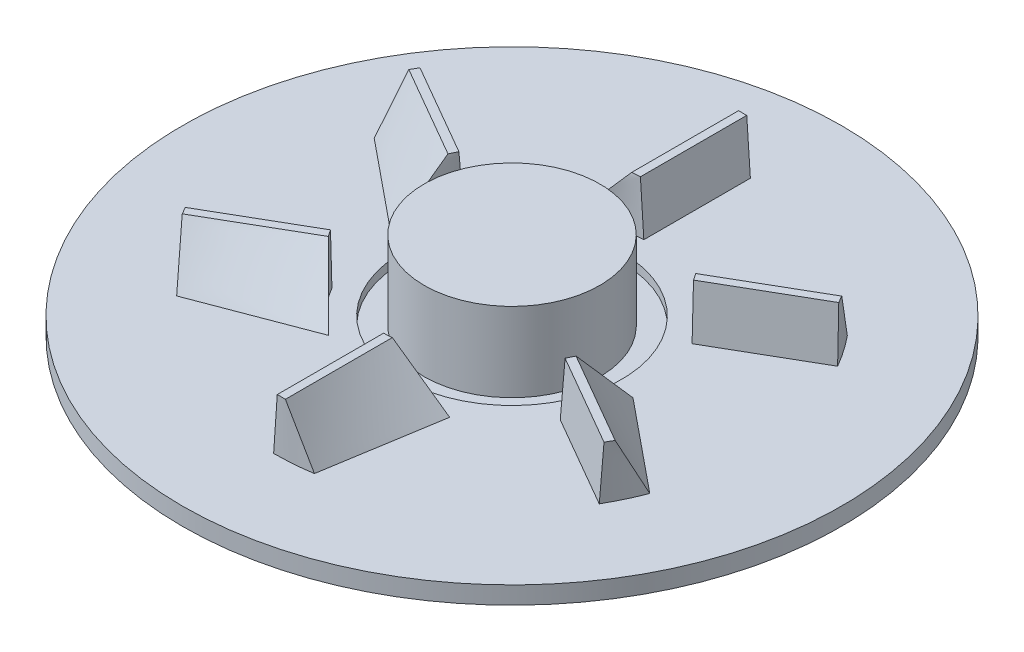
from build123d import *

# Parameters (mm, degrees)
SKETCH2_R           = 37.5
BOSS_EXTRUDE1_DEPTH = 2
CIRPATTERN1_COUNT   = 6
SKETCH6_R           = 12.5
CUT_EXTRUDE1_DEPTH  = 1
SKETCH7_R           = 10
BOSS_EXTRUDE2_DEPTH = 9
SKETCH8_R           = 5
CUT_EXTRUDE2_DEPTH  = 8


with BuildPart() as part:
    # Sketch2 → Boss-Extrude1 (new body)
    with BuildSketch(Plane(origin=(0, 0, 0), x_dir=(1, 0, 0), z_dir=(0, 1, 0))):
        with Locations(Location((0, 0, 0), (0, 0, 270))):
            Circle(SKETCH2_R)
    extrude(amount=BOSS_EXTRUDE1_DEPTH)

    # Sketch3 for Loft1 → Loft1 section 0
    with BuildSketch(Plane(origin=(0, 2, 0), x_dir=(1, 0, 0), z_dir=(0, 1, 0))):
        with BuildLine():
            Line((0, -15), (0, -27.124270964))
            # circular arc as an exact rational Bezier (weights 1, cos(half-angle), 1)
            Bezier((0, -27.124270964), (2.164566304, -27.124270964), (4.301737718, -26.780984447), weights=[1, 0.996830963, 1])
            Line((4.301737718, -26.780984447), (6.447780139, -13.543490366))
            Bezier((6.447780139, -13.543490366), (3.388397874, -15), (0, -15), weights=[1, 0.975422821, 1])
        make_face()
    # Sketch4 for Loft1 → Loft1 section 1
    with BuildSketch(Plane(origin=(0, 8, 0), x_dir=(1, 0, 0), z_dir=(0, 1, 0))):
        with BuildLine():
            Line((0.4, -15.012151174), (0.4, -27.112269684))
            Bezier((0.4, -27.112269684), (0.86490704, -27.099253481), (1.32975035, -27.114375462), weights=[1, 0.999542352, 1])
            Line((1.32975035, -27.114375462), (1.32975035, -14.94692609))
            Line((1.32975035, -14.94692609), (0.4, -15.012151174))
        make_face()
    loft1 = loft()

    # CirPattern1: Loft1 ×6 about axis
    cirpattern1_axis = Axis((0, -1000, 0), (0, 1, 0))
    for i in range(1, CIRPATTERN1_COUNT):
        add(loft1.rotate(cirpattern1_axis, i * 360 / CIRPATTERN1_COUNT))

    # Sketch6 → Cut-Extrude1 (cut)
    with BuildSketch(Plane(origin=(0, 2, 0), x_dir=(1, 0, 0), z_dir=(0, 1, 0))):
        with Locations(Location((0, 0, 0), (0, 0, 270))):
            Circle(SKETCH6_R)
    extrude(amount=-CUT_EXTRUDE1_DEPTH, mode=Mode.SUBTRACT)

    # Sketch7 → Boss-Extrude2 (add)
    with BuildSketch(Plane(origin=(0, 1, 0), x_dir=(1, 0, 0), z_dir=(0, 1, 0))):
        with Locations(Location((0, 0, 0), (0, 0, 270))):
            Circle(SKETCH7_R)
    extrude(amount=BOSS_EXTRUDE2_DEPTH)

    # Sketch8 → Cut-Extrude2 (cut)
    with BuildSketch(Plane.XZ):
        with Locations(Location((0, 0, 0), (0, 0, 270))):
            Circle(SKETCH8_R)
    extrude(amount=-CUT_EXTRUDE2_DEPTH, mode=Mode.SUBTRACT)


solid = part.part
